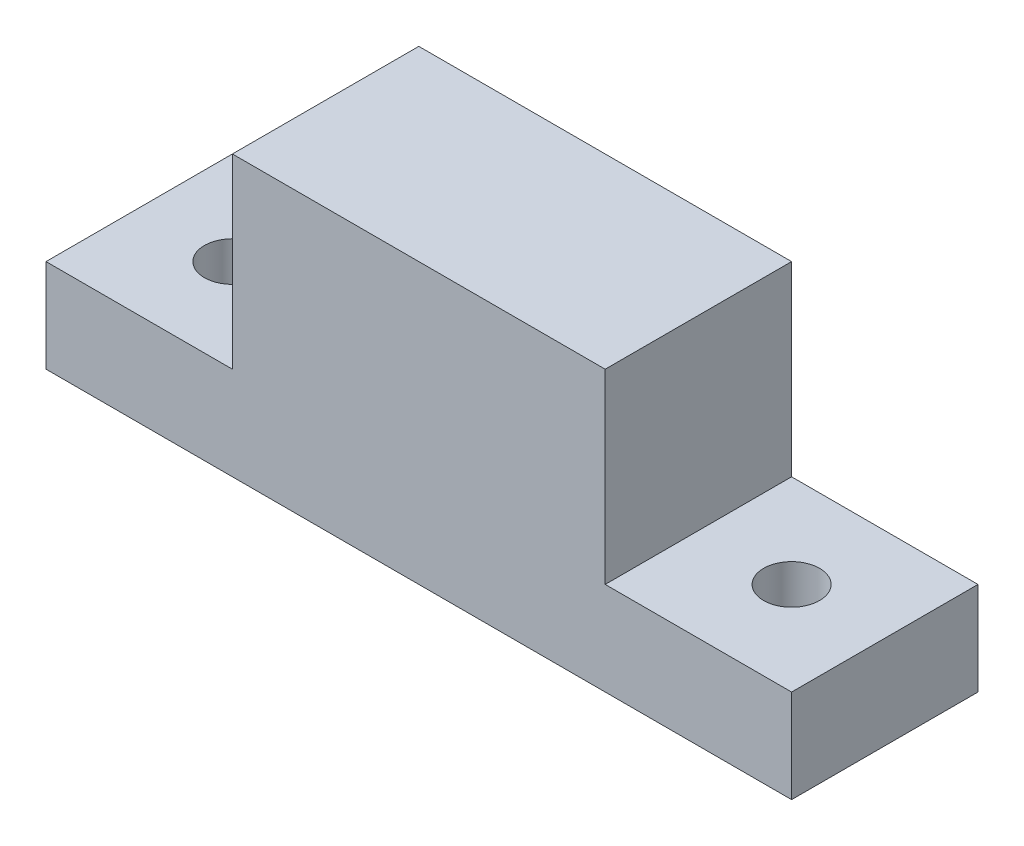
from build123d import *

# Parameters (mm, degrees)
SKETCH_1_W      = 80
SKETCH_1_H      = 20
SKETCH_1_R      = 3
EXTRUDE_1_DEPTH = 5
SKETCH_2_W      = 40
SKETCH_2_H      = 20
EXTRUDE_2_DEPTH = 20
SKETCH_3_W      = 80
SKETCH_3_H      = 20
SKETCH_3_R      = 5
SKETCH_3_R_2    = 2.5
EXTRUDE_3_DEPTH = 5


with BuildPart() as part:
    # 草图1 → 凸台-拉伸1 (new body)
    with BuildSketch(Plane(origin=(0, 0, 0), x_dir=(1, 0, 0), z_dir=(0, 1, 0))):
        Rectangle(SKETCH_1_W, SKETCH_1_H)
        with Locations(Location((-30, 0, 0), (0, 0, 270))):
            Circle(SKETCH_1_R, mode=Mode.SUBTRACT)
        with Locations(Location((30, 0, 0), (0, 0, 270))):
            Circle(SKETCH_1_R, mode=Mode.SUBTRACT)
    extrude(amount=EXTRUDE_1_DEPTH)

    # 草图2 → 凸台-拉伸2 (add)
    with BuildSketch(Plane(origin=(0, 5, 0), x_dir=(1, 0, 0), z_dir=(0, 1, 0))):
        Rectangle(SKETCH_2_W, SKETCH_2_H)
    extrude(amount=EXTRUDE_2_DEPTH)

    # 草图3 → 凸台-拉伸3 (add)
    with BuildSketch(Plane.XZ):
        Rectangle(SKETCH_3_W, SKETCH_3_H)
        with Locations(Location((-30, 0, 0), (0, 0, 270))):
            Circle(SKETCH_3_R, mode=Mode.SUBTRACT)
        with Locations(Location((30, 0, 0), (0, 0, 270))):
            Circle(SKETCH_3_R, mode=Mode.SUBTRACT)
        with Locations(Location((0, 0, 0), (0, 0, 270))):
            Circle(SKETCH_3_R_2, mode=Mode.SUBTRACT)
    extrude(amount=EXTRUDE_3_DEPTH)


solid = part.part
